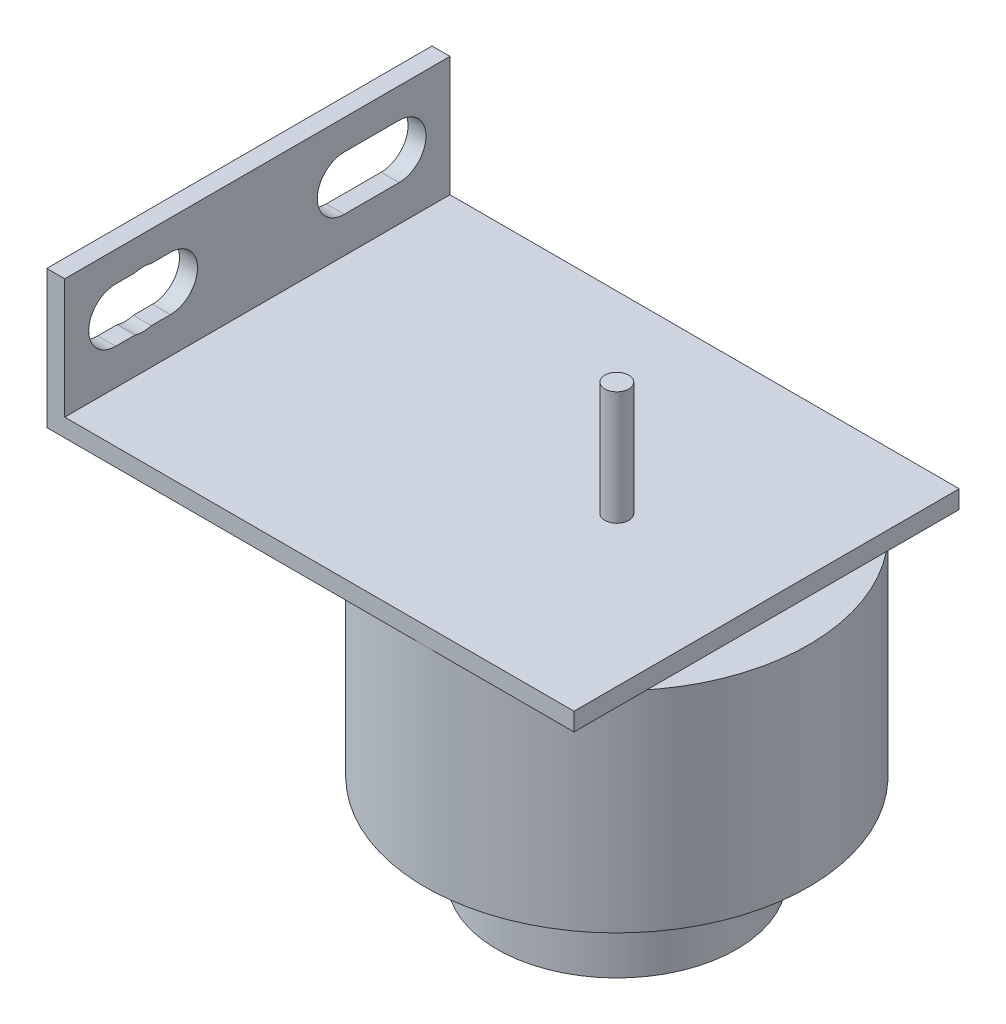
from build123d import *

# Parameters (mm, degrees)
EXTRU_MINCE1_DEPTH      = 16.075
ENL_V_MAT_EXTRU_1_DEPTH = 3
ESQUISSE3_R             = 1
BOSS_EXTRU_1_DEPTH      = 9.5
ESQUISSE4_R             = 16
BOSS_EXTRU_2_DEPTH      = 17.5
ESQUISSE5_R             = 2.35
ENL_V_MAT_EXTRU_2_DEPTH = 54.112198458
ESQUISSE6_R             = 10
BOSS_EXTRU_3_DEPTH      = 25


with BuildPart() as part:
    # Esquisse1 → Extru.-Mince1 (new, symmetric)
    with BuildSketch(Plane.XY):
        Polygon((0, 11.5), (0, 0), (44, 0), (44, 1.5), (1.5, 1.5), (1.5, 11.5), align=None)
    extrude(amount=EXTRU_MINCE1_DEPTH, both=True)

    # Esquisse2 → Enlèv. mat.-Extru.1 (cut)
    with BuildSketch(Plane.ZY):
        with BuildLine():
            Line((-11.825, 9), (-7.25, 9))
            ThreePointArc((-7.25, 9), (-5, 6.75), (-7.25, 4.5))
            Line((-7.25, 4.5), (-11.825, 4.5))
            ThreePointArc((-11.825, 4.5), (-14.075, 6.75), (-11.825, 9))
        make_face()
        with BuildLine():
            Line((11.825, 9), (7.25, 9))
            ThreePointArc((7.25, 9), (5, 6.75), (7.25, 4.5))
            Line((7.25, 4.5), (11.825, 4.5))
            ThreePointArc((11.825, 4.5), (14.075, 6.75), (11.825, 9))
        make_face()
    extrude(amount=-ENL_V_MAT_EXTRU_1_DEPTH, mode=Mode.SUBTRACT)

    # Esquisse5 → Enlèv. mat.-Extru.2 (cut, through all)
    with BuildSketch(Plane.ZY):
        with Locations((9.5375, 6.75)):
            Circle(ESQUISSE5_R)
    extrude(amount=-ENL_V_MAT_EXTRU_2_DEPTH, mode=Mode.SUBTRACT)


with BuildPart() as body_2:
    # Esquisse3 → Boss.-Extru.1 (new body)
    with BuildSketch(Plane(origin=(0, 1.5, 0), x_dir=(1, 0, 0), z_dir=(0, 1, 0))):
        with Locations((31.5, 0)):
            Circle(ESQUISSE3_R)
    extrude(amount=BOSS_EXTRU_1_DEPTH)


with BuildPart() as body_3:
    # Esquisse4 → Boss.-Extru.2 (new body)
    with BuildSketch(Plane.XZ):
        with Locations((31.5, 0)):
            Circle(ESQUISSE4_R)
    extrude(amount=BOSS_EXTRU_2_DEPTH)

    # Esquisse6 → Boss.-Extru.3 (add)
    with BuildSketch(Plane.XZ):
        with Locations((31.5, 0)):
            Circle(ESQUISSE6_R)
    extrude(amount=BOSS_EXTRU_3_DEPTH)


solid = Compound([part.part, body_2.part, body_3.part])
